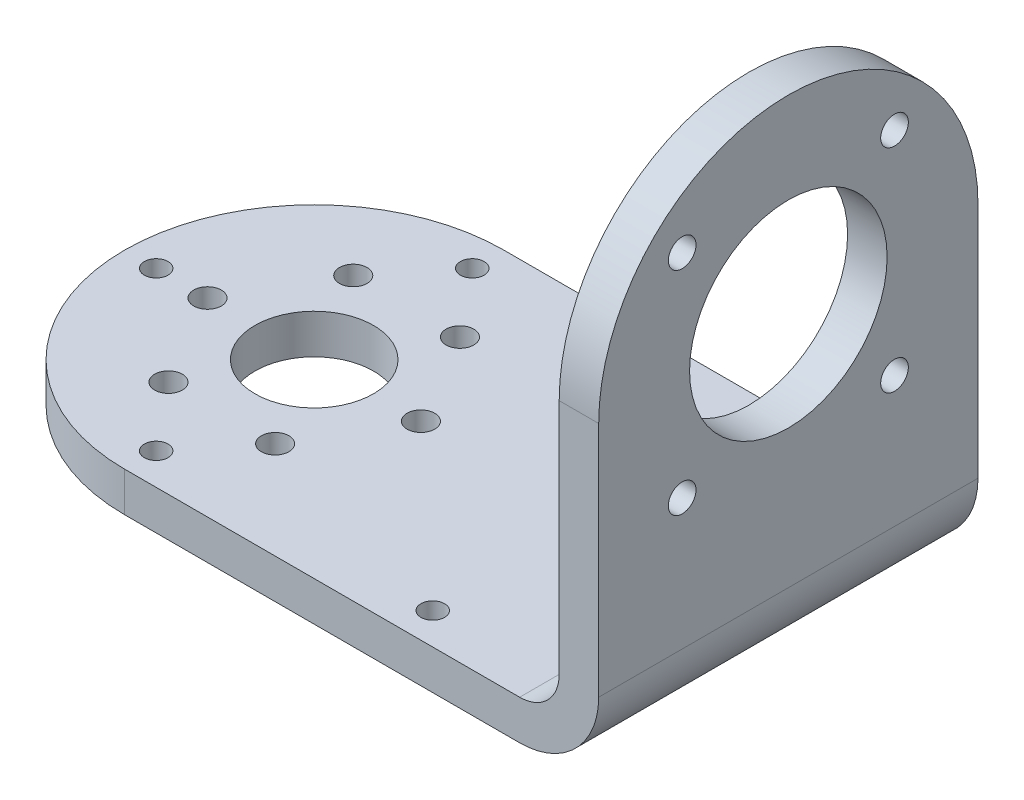
from build123d import *

# Parameters (mm, degrees)
EXTRUDE_1_DEPTH     = 5
EXTRUDE_2_DEPTH     = 5
SKETCH_3_R          = 1.75
CUT_EXTRUDE_1_DEPTH = 21
SKETCH_4_R          = 1.75
CUT_EXTRUDE_2_DEPTH = 21
FILLET_1_R          = 5
FILLET_2_R          = 10
SKETCH_6_R          = 1.5
CUT_EXTRUDE_4_DEPTH = 10
SKETCH_7_R          = 7.5
CUT_EXTRUDE_5_DEPTH = 10
SKETCH_8_R          = 12.5
CUT_EXTRUDE_6_DEPTH = 10


with BuildPart() as part:
    # 草图1 → 凸台-拉伸1 (new body)
    with BuildSketch(Plane(origin=(0, 0, 0), x_dir=(1, 0, 0), z_dir=(0, 1, 0))):
        with BuildLine():
            ThreePointArc((0, 24), (-24, 0), (0, -24))
            Line((0, -24), (60, -24))
            Line((60, -24), (60, 24))
            Line((60, 24), (0, 24))
        make_face()
    extrude(amount=EXTRUDE_1_DEPTH)

    # 草图2 → 凸台-拉伸2 (add)
    with BuildSketch(Plane(origin=(60, 0, 0), x_dir=(0, 0, -1), z_dir=(1, 0, 0))):
        with BuildLine():
            ThreePointArc((24, 40), (0, 64), (-24, 40))
            Line((-24, 40), (-24, 0))
            Line((-24, 0), (24, 0))
            Line((24, 0), (24, 40))
        make_face()
    extrude(amount=-EXTRUDE_2_DEPTH)

    # 草图3 → 切除-拉伸1 (cut)
    with BuildSketch(Plane(origin=(0, 5, 0), x_dir=(1, 0, 0), z_dir=(0, 1, 0))):
        with Locations(Location((-13.5, 0, 0), (0, 0, 270))):
            Circle(SKETCH_3_R)
        with Locations(Location((-6.75, 11.691342951, 0), (0, 0, 270))):
            Circle(SKETCH_3_R)
        with Locations(Location((6.75, 11.691342951, 0), (0, 0, 270))):
            Circle(SKETCH_3_R)
        with Locations(Location((13.5, 0, 0), (0, 0, 270))):
            Circle(SKETCH_3_R)
        with Locations(Location((6.75, -11.691342951, 0), (0, 0, 270))):
            Circle(SKETCH_3_R)
        with Locations(Location((-6.75, -11.691342951, 0), (0, 0, 270))):
            Circle(SKETCH_3_R)
    extrude(amount=-CUT_EXTRUDE_1_DEPTH, mode=Mode.SUBTRACT)

    # 草图4 → 切除-拉伸2 (cut)
    with BuildSketch(Plane(origin=(60, 0, 0), x_dir=(0, 0, -1), z_dir=(1, 0, 0))):
        with Locations((-13.435028843, 53.435028843)):
            Circle(SKETCH_4_R)
        with Locations((13.435028843, 53.435028843)):
            Circle(SKETCH_4_R)
        with Locations((13.435028843, 26.564971157)):
            Circle(SKETCH_4_R)
        with Locations((-13.435028843, 26.564971157)):
            Circle(SKETCH_4_R)
    extrude(amount=-CUT_EXTRUDE_2_DEPTH, mode=Mode.SUBTRACT)

    # 圆角1
    fillet_1_edges = [part.edges().sort_by_distance(p)[0] for p in [
        (55, 5, 0),
    ]]
    fillet(fillet_1_edges, radius=FILLET_1_R)

    # 圆角2
    fillet_2_edges = [part.edges().sort_by_distance(p)[0] for p in [
        (60, 0, 0),
    ]]
    fillet(fillet_2_edges, radius=FILLET_2_R)

    # 草图6 → 切除-拉伸4 (cut)
    with BuildSketch(Plane(origin=(0, 5, 0), x_dir=(1, 0, 0), z_dir=(0, 1, 0))):
        with Locations(Location((0, 20, 0), (0, 0, 270))):
            Circle(SKETCH_6_R)
        with Locations(Location((35, 20, 0), (0, 0, 270))):
            Circle(SKETCH_6_R)
        with Locations(Location((35, -20, 0), (0, 0, 270))):
            Circle(SKETCH_6_R)
        with Locations(Location((0, -20, 0), (0, 0, 270))):
            Circle(SKETCH_6_R)
        with Locations(Location((-20, 0, 0), (0, 0, 270))):
            Circle(SKETCH_6_R)
    extrude(amount=-CUT_EXTRUDE_4_DEPTH, mode=Mode.SUBTRACT)

    # 草图7 → 切除-拉伸5 (cut)
    with BuildSketch(Plane(origin=(0, 5, 0), x_dir=(1, 0, 0), z_dir=(0, 1, 0))):
        with Locations(Location((0, 0, 0), (0, 0, 270))):
            Circle(SKETCH_7_R)
    extrude(amount=-CUT_EXTRUDE_5_DEPTH, mode=Mode.SUBTRACT)

    # 草图8 → 切除-拉伸6 (cut)
    with BuildSketch(Plane(origin=(60, 0, 0), x_dir=(0, 0, -1), z_dir=(1, 0, 0))):
        with Locations((0, 40)):
            Circle(SKETCH_8_R)
    extrude(amount=-CUT_EXTRUDE_6_DEPTH, mode=Mode.SUBTRACT)


solid = part.part
